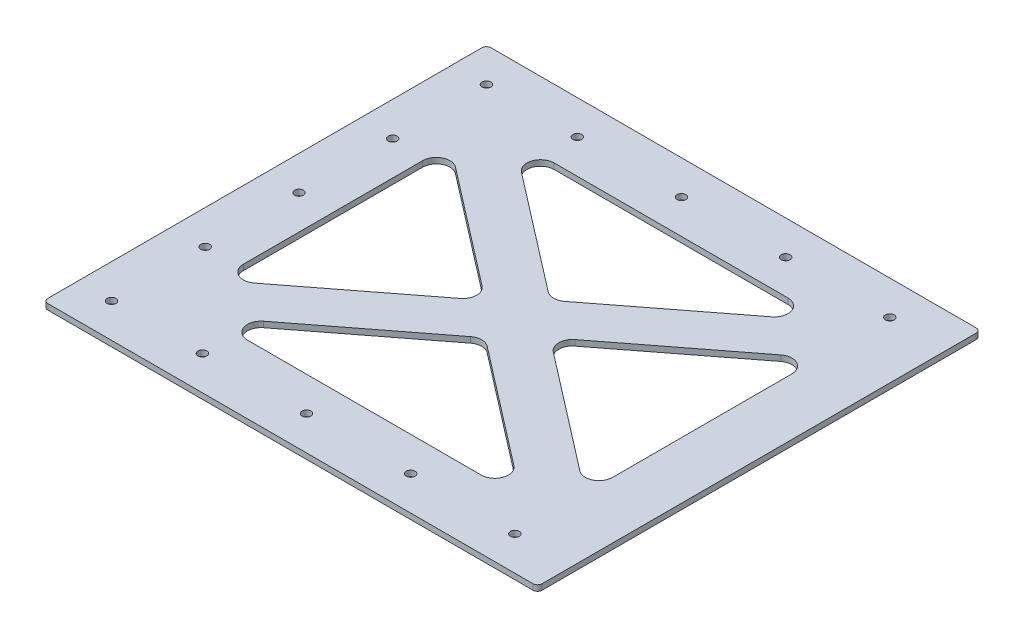
from build123d import *

# Parameters (mm, degrees)
SKETCH1_W                    = 276.225
SKETCH1_H                    = 247.65
BOSS_EXTRUDE1_DEPTH          = 3.175
CUT_EXTRUDE1_DEPTH           = 371.999802898
F_10_0_1935_DIAMETER_HOLE1_D = 4.9149
FILLET1_R                    = 7.62
FILLET2_R                    = 2.54


with BuildPart() as part:
    # Sketch1 → Boss-Extrude1 (new body)
    with BuildSketch(Plane(origin=(0, 0, 0), x_dir=(1, 0, 0), z_dir=(0, 1, 0))):
        with Locations((138.1125, 123.825)):
            Rectangle(SKETCH1_W, SKETCH1_H)
    extrude(amount=BOSS_EXTRUDE1_DEPTH)

    # Sketch2 → Cut-Extrude1 (cut, through all)
    with BuildSketch(Plane(origin=(0, 3.175, 0), x_dir=(1, 0, 0), z_dir=(0, 1, 0))):
        Polygon((38.1, 58.213550587), (123.17774594, 123.825), (38.1, 189.436449413), align=None)
        Polygon((53.611450054, 209.55), (141.2875, 141.93475406), (228.963549946, 209.55), align=None)
        Polygon((159.39725406, 123.825), (244.475, 189.436449413), (244.475, 58.213550587), align=None)
        Polygon((141.2875, 105.71524594), (228.963549946, 38.1), (53.611450054, 38.1), align=None)
    extrude(amount=-CUT_EXTRUDE1_DEPTH, mode=Mode.SUBTRACT)

    # #10 (0.1935) Diameter Hole1 (through all)
    with Locations(Plane(origin=(0, 3.175, 0), x_dir=(1, 0, 0), z_dir=(0, 1, 0))):
        with Locations((69.85, 19.05), (69.85, 228.6), (19.05, 228.6), (19.05, 176.2125), (19.05, 123.825), (19.05, 71.4375), (19.05, 19.05), (128.058333333, 228.6), (186.266666667, 228.6), (244.475, 228.6), (244.475, 19.05), (186.266666667, 19.05), (128.058333333, 19.05)):
            Hole(F_10_0_1935_DIAMETER_HOLE1_D / 2)

    # Fillet1
    fillet1_edges = [part.edges().sort_by_distance(p)[0] for p in [
        (53.611450054, 1.5875, -38.1),
        (141.2875, 1.5875, -105.71524594),
        (228.963549946, 1.5875, -38.1),
        (53.611450054, 1.5875, -209.55),
        (228.963549946, 1.5875, -209.55),
        (141.2875, 1.5875, -141.93475406),
        (244.475, 1.5875, -58.213550587),
        (159.39725406, 1.5875, -123.825),
        (244.475, 1.5875, -189.436449413),
        (38.1, 1.5875, -58.213550587),
        (38.1, 1.5875, -189.436449413),
        (123.17774594, 1.5875, -123.825),
    ]]
    fillet(fillet1_edges, radius=FILLET1_R)

    # Fillet2
    fillet2_edges = [part.edges().sort_by_distance(p)[0] for p in [
        (0, 1.5875, -247.65),
        (276.225, 1.5875, -247.65),
        (276.225, 1.5875, 0),
        (0, 1.5875, 0),
    ]]
    fillet(fillet2_edges, radius=FILLET2_R)


solid = part.part
